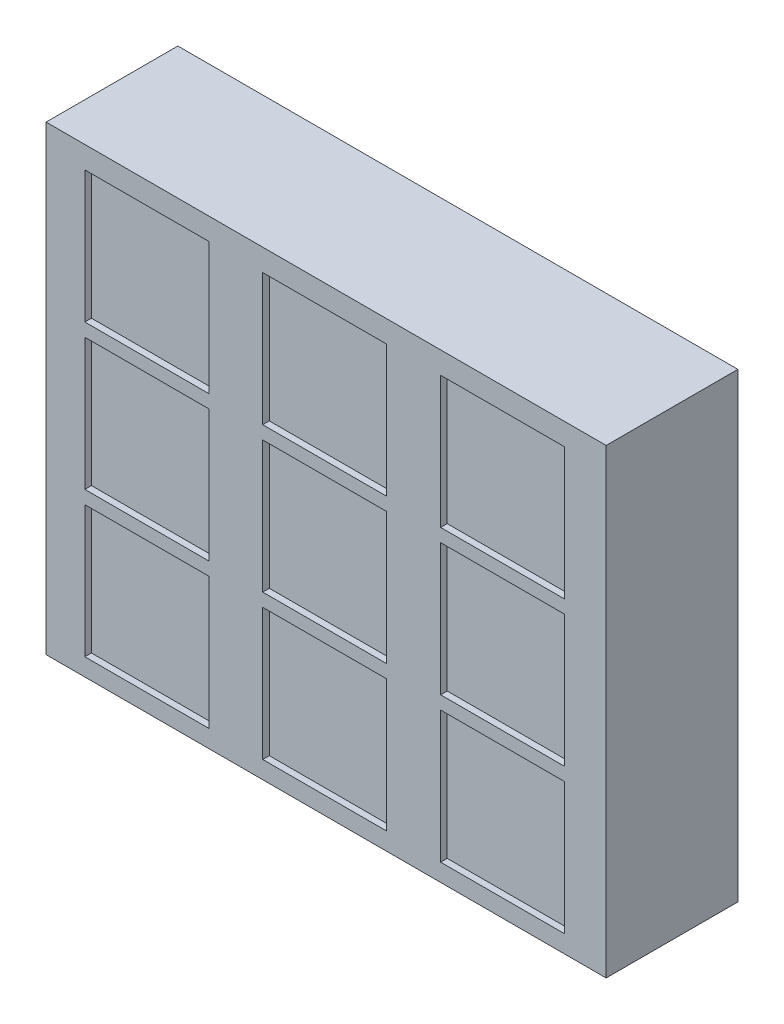
from build123d import *

# Parameters (mm, degrees)
SKETCH1_W           = 215.9
SKETCH1_H           = 177.8
BOSS_EXTRUDE1_DEPTH = 50.8
SKETCH2_W           = 47.801549888
SKETCH2_H           = 50.8
CUT_EXTRUDE1_DEPTH  = 2.54
SKETCH3_W           = 50.8
SKETCH3_H           = 50.8
CUT_EXTRUDE2_DEPTH  = 5.08


with BuildPart() as part:
    # Sketch1 → Boss-Extrude1 (new body)
    with BuildSketch(Plane.XY):
        Rectangle(SKETCH1_W, SKETCH1_H)
    extrude(amount=BOSS_EXTRUDE1_DEPTH)

    # Sketch2 → Cut-Extrude1 (cut)
    with BuildSketch(Plane.XY.offset(50.8)):
        with Locations((-0.538457271, 55.022877852)):
            Rectangle(SKETCH2_W, SKETCH2_H)
        with Locations((-69.118457271, 55.022877852)):
            Rectangle(SKETCH2_W, SKETCH2_H)
        with Locations((68.041542729, 55.022877852)):
            Rectangle(SKETCH2_W, SKETCH2_H)
        with Locations((-69.118457271, -0.857122148)):
            Rectangle(SKETCH2_W, SKETCH2_H)
        with Locations((-0.538457271, -0.857122148)):
            Rectangle(SKETCH2_W, SKETCH2_H)
        with Locations((68.041542729, -0.857122148)):
            Rectangle(SKETCH2_W, SKETCH2_H)
        with Locations((-69.118457271, -56.737122148)):
            Rectangle(SKETCH2_W, SKETCH2_H)
        with Locations((-0.538457271, -56.737122148)):
            Rectangle(SKETCH2_W, SKETCH2_H)
        with Locations((68.041542729, -56.737122148)):
            Rectangle(SKETCH2_W, SKETCH2_H)
    extrude(amount=-CUT_EXTRUDE1_DEPTH, mode=Mode.SUBTRACT)

    # Sketch3 → Cut-Extrude2 (cut)
    with BuildSketch(Plane(origin=(0, 0, 0), x_dir=(-1, 0, 0), z_dir=(0, 0, -1))):
        with Locations((58.475064597, 54.782080131)):
            Rectangle(SKETCH3_W, SKETCH3_H)
        with Locations((58.475064597, -59.517919869)):
            Rectangle(SKETCH3_W, SKETCH3_H)
        with Locations((-81.224935403, 3.982080131)):
            Rectangle(SKETCH3_W, SKETCH3_H)
    extrude(amount=-CUT_EXTRUDE2_DEPTH, mode=Mode.SUBTRACT)


solid = part.part
